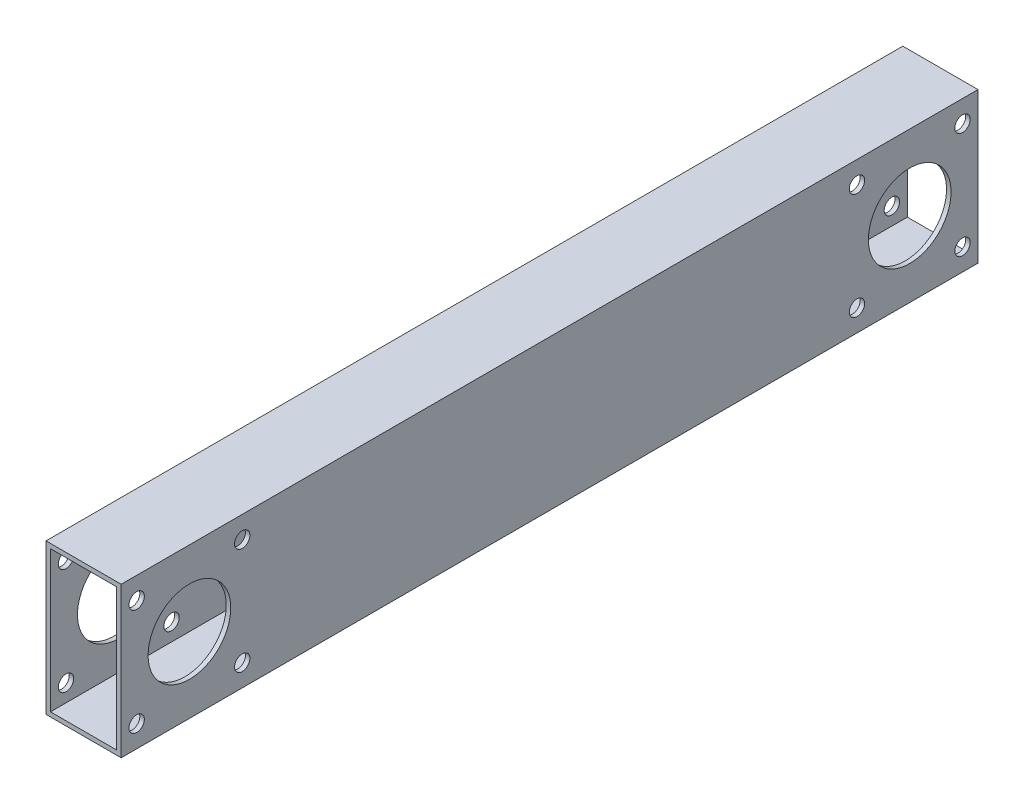
from build123d import *

# Parameters (mm, degrees)
SKETCH1_W           = 50
SKETCH1_H           = 100
SKETCH1_W_2         = 44
SKETCH1_H_2         = 94
BOSS_EXTRUDE1_DEPTH = 570
SKETCH2_R           = 27.5
CUT_EXTRUDE1_DEPTH  = 570
SKETCH3_R           = 5.115212426
CUT_EXTRUDE2_DEPTH  = 570


with BuildPart() as part:
    # Sketch1 → Boss-Extrude1 (new body)
    with BuildSketch(Plane.XY):
        with Locations((25, 50)):
            Rectangle(SKETCH1_W, SKETCH1_H)
        with Locations((25, 50)):
            Rectangle(SKETCH1_W_2, SKETCH1_H_2, mode=Mode.SUBTRACT)
    extrude(amount=BOSS_EXTRUDE1_DEPTH)

    # Sketch2 → Cut-Extrude1 (cut)
    with BuildSketch(Plane.ZY):
        with Locations((45.413528793, 50)):
            Circle(SKETCH2_R)
        with Locations(Location((524.586471207, 50, 0), (0, 0, 180))):
            Circle(SKETCH2_R)
    extrude(amount=-CUT_EXTRUDE1_DEPTH, mode=Mode.SUBTRACT)

    # Sketch3 → Cut-Extrude2 (cut)
    with BuildSketch(Plane.ZY):
        with Locations((80.527883109, 85.459683227)):
            Circle(SKETCH3_R)
        with Locations((10.299174477, 14.540316773)):
            Circle(SKETCH3_R)
        with Locations((80.527883109, 14.540316773)):
            Circle(SKETCH3_R)
        with Locations((559.700825523, 85.459683227)):
            Circle(SKETCH3_R)
        with Locations((489.472116891, 85.459683227)):
            Circle(SKETCH3_R)
        with Locations((489.472116891, 14.540316773)):
            Circle(SKETCH3_R)
        with Locations((559.700825523, 14.540316773)):
            Circle(SKETCH3_R)
        with Locations((10.299174477, 85.459683227)):
            Circle(SKETCH3_R)
    extrude(amount=-CUT_EXTRUDE2_DEPTH, mode=Mode.SUBTRACT)


solid = part.part
